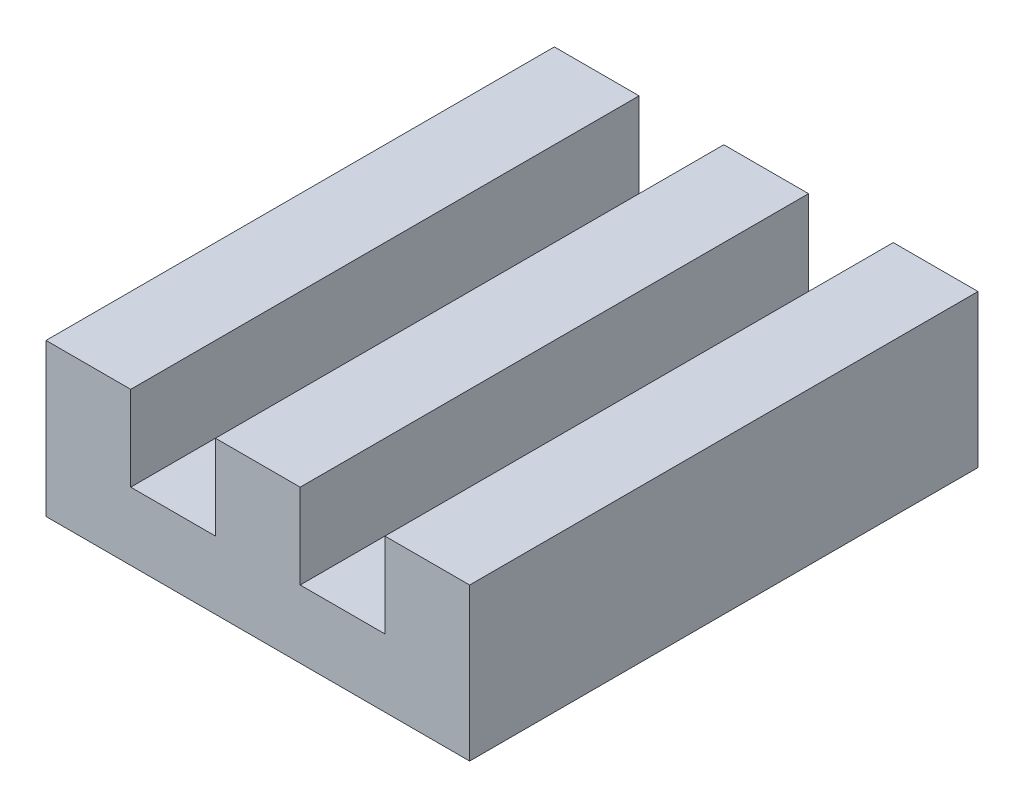
from build123d import *

# Parameters (mm, degrees)
BOSS_EXTRU_1_DEPTH      = 60
ESQUISSE2_W             = 10
ESQUISSE2_H             = 70.243389495
ENL_V_MAT_EXTRU_1_DEPTH = 10


with BuildPart() as part:
    # Esquisse1 → Boss.-Extru.1 (new body)
    with BuildSketch(Plane.XY):
        Polygon((0, 0), (50, 0), (50, 9), (50, 18), (0, 18), align=None)
    extrude(amount=BOSS_EXTRU_1_DEPTH)

    # Esquisse2 → Enlèv. mat.-Extru.1 (cut)
    with BuildSketch(Plane(origin=(0, 18, 0), x_dir=(1, 0, 0), z_dir=(0, 1, 0))):
        with Locations((15, -30.175170548)):
            Rectangle(ESQUISSE2_W, ESQUISSE2_H)
        with Locations((35, -30.175170548)):
            Rectangle(ESQUISSE2_W, ESQUISSE2_H)
    extrude(amount=-ENL_V_MAT_EXTRU_1_DEPTH, mode=Mode.SUBTRACT)


solid = part.part
